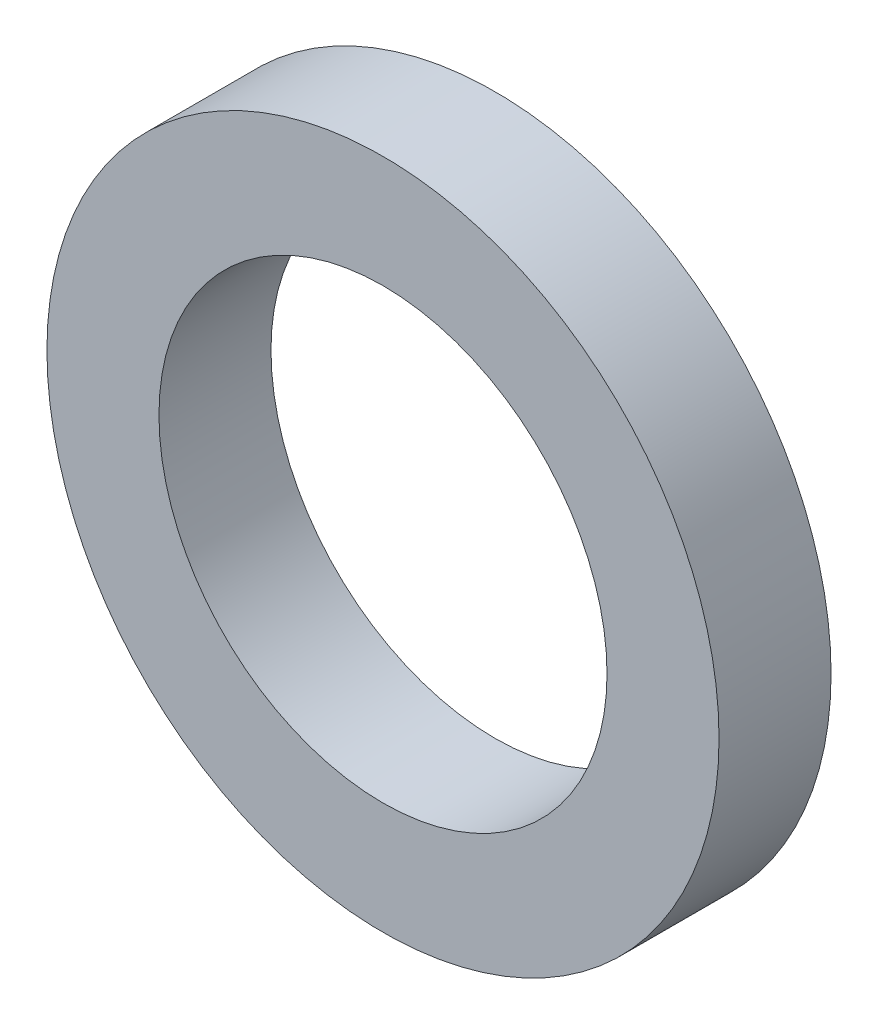
from build123d import *

# Parameters (mm, degrees)
SKETCH1_R          = 3
PLA_WASHER_DEPTH   = 1
SKETCH2_R          = 2
CUT_EXTRUDE1_DEPTH = 5.358898944


with BuildPart() as part:
    # Sketch1 → PLA_washer (new body)
    with BuildSketch(Plane.XY):
        Circle(SKETCH1_R)
    extrude(amount=PLA_WASHER_DEPTH)

    # Sketch2 → Cut-Extrude1 (cut, through all)
    with BuildSketch(Plane.XY.offset(1)):
        Circle(SKETCH2_R)
    extrude(amount=-CUT_EXTRUDE1_DEPTH, mode=Mode.SUBTRACT)


solid = part.part
